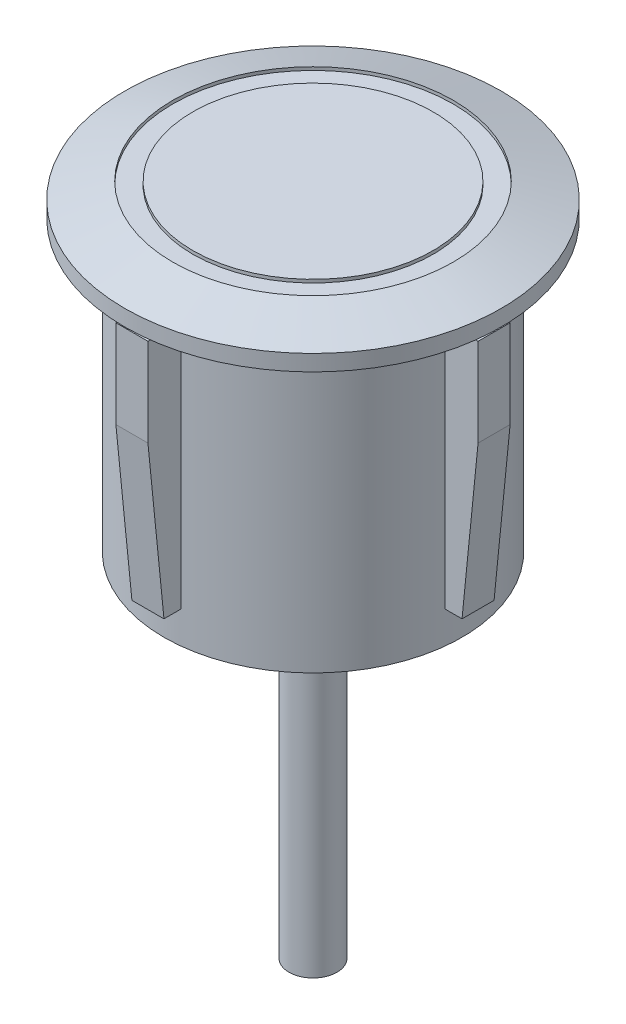
from build123d import *
from OCP.BRepFilletAPI import BRepFilletAPI_MakeChamfer

# Parameters (mm, degrees)
SKETCH_1_R          = 9.3
EXTRUDE_1_DEPTH     = 20
SKETCH_2_R          = 11.75
EXTRUDE_2_DEPTH     = 2
CHAMFER_1_SIZE      = 1
CHAMFER_1_SIZE2     = 3
SKETCH_3_R          = 1.5
EXTRUDE_3_DEPTH     = 22
EXTRUDE_START       = -2
SKETCH_4_W          = 2
SKETCH_4_H          = 4
SKETCH_4_W_2        = 4
SKETCH_4_H_2        = 2
EXTRUDE_4_DEPTH     = 15.5
CHAMFER_2_SIZE      = 10
CHAMFER_2_SIZE2     = 1
SKETCH_5_R          = 8.75
SKETCH_5_R_2        = 7.5
CUT_EXTRUDE_1_DEPTH = 0.2


with BuildPart() as part:
    # 草图1 → 凸台-拉伸1 (new body)
    with BuildSketch(Plane(origin=(0, 0, 0), x_dir=(1, 0, 0), z_dir=(0, 1, 0))):
        with Locations(Location((0, 0, 0), (0, 0, 270))):
            Circle(SKETCH_1_R)
    extrude(amount=EXTRUDE_1_DEPTH)

    # 草图2 → 凸台-拉伸2 (add)
    with BuildSketch(Plane(origin=(0, 20, 0), x_dir=(1, 0, 0), z_dir=(0, 1, 0))):
        with Locations(Location((0, 0, 0), (0, 0, 270))):
            Circle(SKETCH_2_R)
    extrude(amount=-EXTRUDE_2_DEPTH)

    # 倒角1
    chamfer_1_edges = [part.edges().sort_by_distance(p)[0] for p in [
        (0, 20, -11.75),
    ]]
    chamfer_1_side = [part.faces().sort_by_distance(p)[0] for p in [
        (0, 19, -11.75),
    ]]
    chamfer(chamfer_1_edges, length=CHAMFER_1_SIZE, length2=CHAMFER_1_SIZE2, reference=chamfer_1_side[0])

    # 草图3 → 凸台-拉伸3 (add)
    with BuildSketch(Plane.XZ):
        with Locations(Location((0, 0, 0), (0, 0, 90))):
            Circle(SKETCH_3_R)
    extrude(amount=EXTRUDE_3_DEPTH)

    # 草图4 → 凸台-拉伸4 (add)
    with BuildSketch(Plane.XZ.offset(EXTRUDE_START)):
        with Locations((0, 9.3)):
            Rectangle(SKETCH_4_W, SKETCH_4_H)
        with Locations((0, -9.3)):
            Rectangle(SKETCH_4_W, SKETCH_4_H)
        with Locations((-9.3, 0)):
            Rectangle(SKETCH_4_W_2, SKETCH_4_H_2)
        with Locations((9.3, 0)):
            Rectangle(SKETCH_4_W_2, SKETCH_4_H_2)
    extrude(amount=-EXTRUDE_4_DEPTH)

    # 倒角2: one chamfer whose edges measure the first distance from different faces: ONE call of the kernel's chamfer builder (chamfer() names one face for all edges)
    chamfer_2_edges_1 = [part.edges().sort_by_distance(p)[0] for p in [
        (0, 2, 11.3),
    ]]
    chamfer_2_side_1 = [part.faces().sort_by_distance(p)[0] for p in [
        (0, 9.75, 11.3),
    ]]
    chamfer_2_edges_2 = [part.edges().sort_by_distance(p)[0] for p in [
        (0, 2, -11.3),
    ]]
    chamfer_2_side_2 = [part.faces().sort_by_distance(p)[0] for p in [
        (0, 9.75, -11.3),
    ]]
    chamfer_2_edges_3 = [part.edges().sort_by_distance(p)[0] for p in [
        (-11.3, 2, 0),
    ]]
    chamfer_2_side_3 = [part.faces().sort_by_distance(p)[0] for p in [
        (-11.3, 9.75, 0),
    ]]
    chamfer_2_edges_4 = [part.edges().sort_by_distance(p)[0] for p in [
        (11.3, 2, 0),
    ]]
    chamfer_2_side_4 = [part.faces().sort_by_distance(p)[0] for p in [
        (11.3, 9.75, 0),
    ]]
    chamfer_2 = BRepFilletAPI_MakeChamfer(part.part.solid().wrapped)
    for e in chamfer_2_edges_1:
        chamfer_2.Add(CHAMFER_2_SIZE, CHAMFER_2_SIZE2, e.wrapped, chamfer_2_side_1[0].wrapped)  # the first distance lies on this face
    for e in chamfer_2_edges_2:
        chamfer_2.Add(CHAMFER_2_SIZE, CHAMFER_2_SIZE2, e.wrapped, chamfer_2_side_2[0].wrapped)  # the first distance lies on this face
    for e in chamfer_2_edges_3:
        chamfer_2.Add(CHAMFER_2_SIZE, CHAMFER_2_SIZE2, e.wrapped, chamfer_2_side_3[0].wrapped)  # the first distance lies on this face
    for e in chamfer_2_edges_4:
        chamfer_2.Add(CHAMFER_2_SIZE, CHAMFER_2_SIZE2, e.wrapped, chamfer_2_side_4[0].wrapped)  # the first distance lies on this face
    add(Compound.cast(chamfer_2.Shape()), mode=Mode.REPLACE)

    # 草图5 → 切除-拉伸1 (cut)
    with BuildSketch(Plane(origin=(0, 20, 0), x_dir=(1, 0, 0), z_dir=(0, 1, 0))):
        with Locations(Location((0, 0, 0), (0, 0, 270))):
            Circle(SKETCH_5_R)
        with Locations(Location((0, 0, 0), (0, 0, 270))):
            Circle(SKETCH_5_R_2, mode=Mode.SUBTRACT)
    extrude(amount=-CUT_EXTRUDE_1_DEPTH, mode=Mode.SUBTRACT)


solid = part.part
